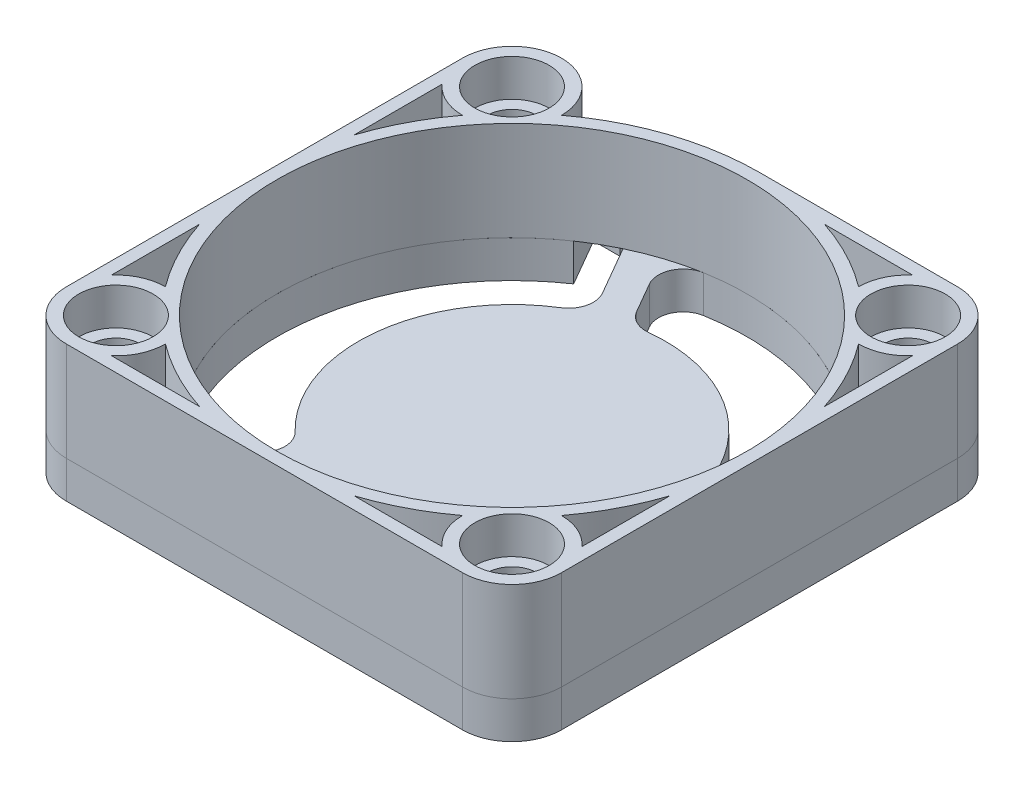
from build123d import *
from build123d.topology import SkipClean

# Parameters (mm, degrees)
SKETCH1_W            = 40
SKETCH1_H            = 40
BOSS_EXTRUDE1_DEPTH  = 8
FILLET1_R            = 4
SKETCH2_R            = 19
CUT_EXTRUDE1_DEPTH   = 8
SKETCH7_R            = 3
CUT_EXTRUDE2_DEPTH   = 3
SKETCH8_R            = 2
CUT_EXTRUDE3_DEPTH   = 29.722813233
CIRPATTERN1_COUNT    = 4
CUT_EXTRUDE4_DEPTH   = 6
CUT_EXTRUDE5_DEPTH   = 6
MIRROR2_COPY_1_DEPTH = 6
CUT_EXTRUDE6_DEPTH   = 30.393876913
SKETCH12_R           = 2
BOSS_EXTRUDE2_DEPTH  = 3
FILLET2_R            = 2


with BuildPart() as part:
    # Sketch1 → Boss-Extrude1 (new body)
    with BuildSketch(Plane(origin=(0, 0, 0), x_dir=(1, 0, 0), z_dir=(0, 1, 0))):
        Rectangle(SKETCH1_W, SKETCH1_H)
    extrude(amount=BOSS_EXTRUDE1_DEPTH)

    # Fillet1
    fillet1_edges = [part.edges().sort_by_distance(p)[0] for p in [
        (-20, 4, -20),
        (20, 4, -20),
        (-20, 4, 20),
        (20, 4, 20),
    ]]
    fillet(fillet1_edges, radius=FILLET1_R)

    # Sketch2 → Cut-Extrude1 (cut)
    with BuildSketch(Plane(origin=(0, 8, 0), x_dir=(1, 0, 0), z_dir=(0, 1, 0))):
        Circle(SKETCH2_R)
    extrude(amount=-CUT_EXTRUDE1_DEPTH, mode=Mode.SUBTRACT)

    # Sketch7 → Cut-Extrude2 (cut)
    with BuildSketch(Plane(origin=(0, 8, 0), x_dir=(1, 0, 0), z_dir=(0, 1, 0))):
        with Locations((-16, 16)):
            Circle(SKETCH7_R)
    cut_extrude2 = extrude(amount=-CUT_EXTRUDE2_DEPTH, mode=Mode.SUBTRACT)

    # Sketch8 → Cut-Extrude3 (cut, through all)
    with BuildSketch(Plane(origin=(0, 5, 0), x_dir=(1, 0, 0), z_dir=(0, 1, 0))):
        with Locations((-16, 16)):
            Circle(SKETCH8_R)
    cut_extrude3 = extrude(amount=-CUT_EXTRUDE3_DEPTH, mode=Mode.SUBTRACT)

    # CirPattern1: Cut-Extrude2, Cut-Extrude3 ×4 about axis
    cirpattern1_axis = Axis((0, 8, 0), (0, 1, 0))
    add([cut_extrude2.rotate(cirpattern1_axis, i * 360 / CIRPATTERN1_COUNT) for i in range(1, CIRPATTERN1_COUNT)], mode=Mode.SUBTRACT)
    add([cut_extrude3.rotate(cirpattern1_axis, i * 360 / CIRPATTERN1_COUNT) for i in range(1, CIRPATTERN1_COUNT)], mode=Mode.SUBTRACT)

    # Sketch9 → Cut-Extrude4 (cut)
    with BuildSketch(Plane(origin=(0, 8, 0), x_dir=(1, 0, 0), z_dir=(0, 1, 0))):
        with BuildLine():
            Line((-19, 13.354248689), (-19, 6.244997998))
            ThreePointArc((-19, 6.244997998), (-17.734993995, 9.244997998), (-16, 12))
            ThreePointArc((-16, 12), (-17.645751311, 12.354248689), (-19, 13.354248689))
        make_face()
        with BuildLine():
            Line((-19, -13.354248689), (-19, -6.244997998))
            ThreePointArc((-19, -6.244997998), (-17.734993995, -9.244997998), (-16, -12))
            ThreePointArc((-16, -12), (-17.645751311, -12.354248689), (-19, -13.354248689))
        make_face()
        with BuildLine():
            Line((19, 13.354248689), (19, 6.244997998))
            ThreePointArc((19, 6.244997998), (17.734993995, 9.244997998), (16, 12))
            ThreePointArc((16, 12), (17.645751311, 12.354248689), (19, 13.354248689))
        make_face()
        with BuildLine():
            Line((19, -13.354248689), (19, -6.244997998))
            ThreePointArc((19, -6.244997998), (17.734993995, -9.244997998), (16, -12))
            ThreePointArc((16, -12), (17.645751311, -12.354248689), (19, -13.354248689))
        make_face()
    extrude(amount=-CUT_EXTRUDE4_DEPTH, mode=Mode.SUBTRACT)

    # Sketch10 → Cut-Extrude5 (cut)
    with BuildSketch(Plane(origin=(0, 8, 0), x_dir=(1, 0, 0), z_dir=(0, 1, 0))):
        with BuildLine():
            Line((-6.244997998, 19), (-13.354248689, 19))
            ThreePointArc((-13.354248689, 19), (-12.354248689, 17.645751311), (-12, 16))
            ThreePointArc((-12, 16), (-9.244997998, 17.734993995), (-6.244997998, 19))
        make_face()
    cut_extrude5 = extrude(amount=-CUT_EXTRUDE5_DEPTH, mode=Mode.SUBTRACT)

    # Mirror1: Cut-Extrude5 across plane
    add(cut_extrude5.mirror(Plane(origin=(0, 0, 0), x_dir=(0, 0, 1), z_dir=(1, 0, 0))), mode=Mode.SUBTRACT)

    # Mirror2: Cut-Extrude5 across plane
    add(cut_extrude5.mirror(Plane.XY), mode=Mode.SUBTRACT)

    # Mirror2 copy 1 sketch → Mirror2 copy 1 (cut)
    with BuildSketch(Plane(origin=(0, 8, 0), x_dir=(-1, 0, 0), z_dir=(0, 1, 0))):
        with BuildLine():
            Line((-6.244997998, 19), (-13.354248689, 19))
            ThreePointArc((-13.354248689, 19), (-12.354248689, 17.645751311), (-12, 16))
            ThreePointArc((-12, 16), (-9.244997998, 17.734993995), (-6.244997998, 19))
        make_face()
    extrude(amount=-MIRROR2_COPY_1_DEPTH, mode=Mode.SUBTRACT)

    # Sketch11 → Cut-Extrude6 (cut, through all)
    with SkipClean():  # the faces are left unmerged after this step: merging them gives an invalid solid
        with BuildSketch(Plane(origin=(0, 8, 0), x_dir=(1, 0, 0), z_dir=(0, 1, 0))):
            with BuildLine():
                Line((-16, 20), (0, 20))
                ThreePointArc((0, 20), (-3.16227766, 19.748417658), (-6.244997998, 19))
                ThreePointArc((-6.244997998, 19), (-9.244997998, 17.734993995), (-12, 16))
                ThreePointArc((-12, 16), (-12.354248689, 17.645751311), (-13.354248689, 19))
                ThreePointArc((-13.354248689, 19), (-14.585786438, 19.741657387), (-16, 20))
            make_face()
        extrude(amount=-CUT_EXTRUDE6_DEPTH, mode=Mode.SUBTRACT)


with BuildPart() as body_2:
    # Sketch12 → Boss-Extrude2 (new body)
    with BuildSketch(Plane.XZ):
        with BuildLine():
            ThreePointArc((16, -20), (18.828427125, -18.828427125), (20, -16))
            Line((20, -16), (20, 16))
            ThreePointArc((20, 16), (18.828427125, 18.828427125), (16, 20))
            Line((16, 20), (-16, 20))
            ThreePointArc((-16, 20), (-18.828427125, 18.828427125), (-20, 16))
            Line((-20, 16), (-20, -16))
            ThreePointArc((-20, -16), (-18.828427125, -18.828427125), (-16, -20))
            Line((-16, -20), (-10.765541095, -20))
            Line((-10.765541095, -20), (-10.765541095, -19.495443458))
            Line((-10.765541095, -19.495443458), (-12.906153085, -19.495443458))
            Line((-12.906153085, -19.495443458), (-10.710920478, -15.693189048))
            ThreePointArc((-10.710920478, -15.693189048), (-18.999973249, -0.031883017), (-10.763528106, 15.657153723))
            Line((-10.763528106, 15.657153723), (-7.443348214, 9.906433459))
            ThreePointArc((-7.443348214, 9.906433459), (-12.300897144, -1.492911913), (-4.85754893, -11.399345372))
            Line((-4.85754893, -11.399345372), (-9.823139195, -20))
            Line((-9.823139195, -20), (16, -20))
        make_face()
        with BuildLine():
            ThreePointArc((18.946160621, -1.429334708), (10.539039791, -15.809131547), (-5.968201284, -18.038308497))
            Line((-5.968201284, -18.038308497), (-2.554183806, -12.125056767))
            ThreePointArc((-2.554183806, -12.125056767), (7.237819317, -10.057575654), (12.308446645, -1.429334708))
            Line((12.308446645, -1.429334708), (18.946160621, -1.429334708))
        make_face(mode=Mode.SUBTRACT)
        with BuildLine():
            ThreePointArc((-8.235240143, 17.122523756), (9.472375122, 16.470401014), (18.941256928, 1.492911913))
            Line((18.941256928, 1.492911913), (12.300897144, 1.492911913))
            ThreePointArc((12.300897144, 1.492911913), (6.167836385, 10.747029862), (-4.916383155, 11.374094829))
            Line((-4.916383155, 11.374094829), (-8.235240143, 17.122523756))
        make_face(mode=Mode.SUBTRACT)
        with Locations((-16, -16)):
            Circle(SKETCH12_R, mode=Mode.SUBTRACT)
        with Locations((16, -16)):
            Circle(SKETCH12_R, mode=Mode.SUBTRACT)
        with Locations((-16, 16)):
            Circle(SKETCH12_R, mode=Mode.SUBTRACT)
        with Locations((16, 16)):
            Circle(SKETCH12_R, mode=Mode.SUBTRACT)
    extrude(amount=BOSS_EXTRUDE2_DEPTH)

    # Fillet2
    fillet2_edges = [body_2.edges().sort_by_distance(p)[0] for p in [
        (-4.85754893, -1.5, -11.399345372),
        (-7.443348214, -1.5, 9.906433459),
        (-10.763528106, -1.5, 15.657153723),
        (18.941256928, -1.5, 1.492911913),
        (12.300897144, -1.5, 1.492911913),
        (-8.235240143, -1.5, 17.122523756),
        (-4.916383155, -1.5, 11.374094829),
        (-2.554183806, -1.5, -12.125056767),
        (-5.968201284, -1.5, -18.038308497),
        (18.946160621, -1.5, -1.429334708),
        (12.308446645, -1.5, -1.429334708),
    ]]
    fillet(fillet2_edges, radius=FILLET2_R)


solid = Compound([part.part, body_2.part])
